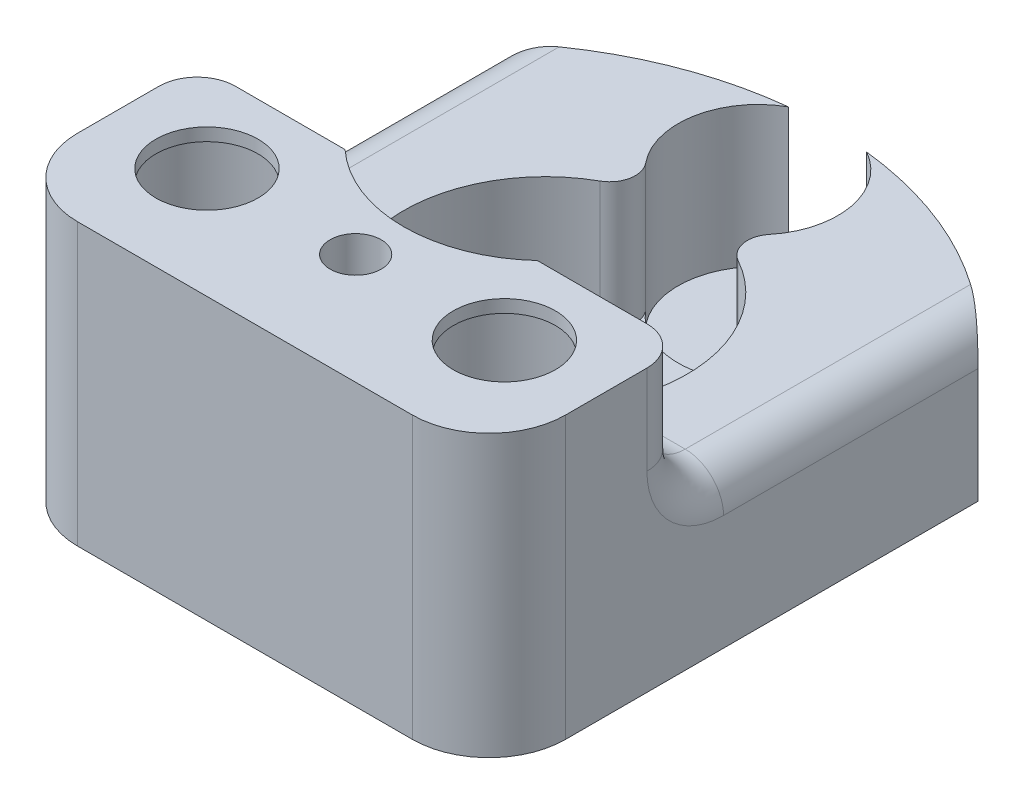
from build123d import *

# Parameters (mm, degrees)
SKETCH1_R                = 34.445
BOSS_EXTRUDE1_DEPTH      = 22
SKETCH15_R               = 34.445
CUT_EXTRUDE2_DEPTH       = 54.450126754
CUT_EXTRUDE4_START       = -1
SKETCH17_R               = 6.2
CUT_EXTRUDE4_DEPTH       = 20
SKETCH18_R               = 7.25
CUT_EXTRUDE5_DEPTH       = 41.489614217
SKETCH19_R               = 6.25
CUT_EXTRUDE7_DEPTH       = 21
SKETCH20_R               = 9.845995641
CUT_EXTRUDE9_DEPTH       = 10
FILLET12_R               = 6
SKETCH23_R               = 4
SKETCH23_R_2             = 2
CUT_EXTRUDE10_DEPTH      = 41.489614217
CUT_EXTRUDE11_START      = -12
CUT_EXTRUDE11_DEPTH      = 29.489614217
FILLET19_R               = 3
CUT_EXTRUDE12_DEPTH      = 10
CUT_EXTRUDE12_DEPTH_BACK = 10
SKETCH25_R               = 11.1
FILLET20_R               = 2


with BuildPart() as part:
    # Sketch1 → Boss-Extrude1 (new body)
    with BuildSketch(Plane(origin=(0, 0, 0), x_dir=(1, 0, 0), z_dir=(0, 1, 0))):
        with Locations(Location((0, 0, 0), (0, 0, 270))):
            Circle(SKETCH1_R)
    extrude(amount=BOSS_EXTRUDE1_DEPTH)

    # Sketch15 → Cut-Extrude2 (cut, through all)
    with BuildSketch(Plane(origin=(0, 22, 0), x_dir=(1, 0, 0), z_dir=(0, 1, 0))):
        Circle(SKETCH15_R)
        with BuildLine():
            Line((-19.109582045, 20.616901016), (-19.109582045, -17.678671312))
            Line((-19.109582045, -17.678671312), (19.109582045, -17.678671312))
            Line((19.109582045, -17.678671312), (19.109582045, 20.616901016))
            ThreePointArc((19.109582045, 20.616901016), (0, 28.111078483), (-19.109582045, 20.616901016))
        make_face(mode=Mode.SUBTRACT)
    extrude(amount=-CUT_EXTRUDE2_DEPTH, mode=Mode.SUBTRACT)

    # Sketch17 → Cut-Extrude4 (cut)
    with BuildSketch(Plane(origin=(0, 22, 0), x_dir=(1, 0, 0), z_dir=(0, 1, 0)).offset(CUT_EXTRUDE4_START)):
        with Locations(Location((-11.644122412, -9.008465082, 0), (0, 0, 270))):
            Circle(SKETCH17_R)
        with Locations(Location((11.644122412, -9.008465082, 0), (0, 0, 90))):
            Circle(SKETCH17_R)
    extrude(amount=-CUT_EXTRUDE4_DEPTH, mode=Mode.SUBTRACT)

    # Sketch18 → Cut-Extrude5 (cut, through all)
    with BuildSketch(Plane(origin=(0, 22, 0), x_dir=(1, 0, 0), z_dir=(0, 1, 0))):
        with Locations(Location((0, 5.846291401, 0), (0, 0, 270))):
            Circle(SKETCH18_R)
    extrude(amount=-CUT_EXTRUDE5_DEPTH, mode=Mode.SUBTRACT)

    # Sketch19 → Cut-Extrude7 (cut)
    with BuildSketch(Plane(origin=(0, 22, 0), x_dir=(1, 0, 0), z_dir=(0, 1, 0))):
        with Locations((0, 22.497935332)):
            Circle(SKETCH19_R)
    extrude(amount=-CUT_EXTRUDE7_DEPTH, mode=Mode.SUBTRACT)

    # Sketch20 → Cut-Extrude9 (cut)
    with BuildSketch(Plane(origin=(0, 22, 0), x_dir=(1, 0, 0), z_dir=(0, 1, 0))):
        with Locations(Location((0, 5.846291401, 0), (0, 0, 270))):
            Circle(SKETCH20_R)
    extrude(amount=-CUT_EXTRUDE9_DEPTH, mode=Mode.SUBTRACT)

    # Fillet12
    fillet12_edges = [part.edges().sort_by_distance(p)[0] for p in [
        (-19.109582045, 11, 17.678671312),
        (19.109582045, 11, 17.678671312),
    ]]
    fillet(fillet12_edges, radius=FILLET12_R)

    # Sketch23 → Cut-Extrude10 (cut, through all)
    with BuildSketch(Plane(origin=(0, 22, 0), x_dir=(1, 0, 0), z_dir=(0, 1, 0))):
        with Locations(Location((-11.644122412, -9.008465082, 0), (0, 0, 270))):
            Circle(SKETCH23_R)
        with Locations(Location((11.644122412, -9.008465082, 0), (0, 0, 270))):
            Circle(SKETCH23_R)
        with Locations(Location((0, -9.008465082, 0), (0, 0, 270))):
            Circle(SKETCH23_R_2)
    extrude(amount=-CUT_EXTRUDE10_DEPTH, mode=Mode.SUBTRACT)

    # Sketch24 → Cut-Extrude11 (cut, through all)
    with BuildSketch(Plane.XZ.offset(CUT_EXTRUDE11_START)):
        with BuildLine():
            Line((-19.109582045, -20.616901016), (-19.109582045, 2.30978602))
            Line((-19.109582045, 2.30978602), (19.109582045, 2.30978602))
            Line((19.109582045, 2.30978602), (19.109582045, -20.616901016))
            ThreePointArc((19.109582045, -20.616901016), (0, -28.111078483), (-19.109582045, -20.616901016))
        make_face()
    extrude(amount=-CUT_EXTRUDE11_DEPTH, mode=Mode.SUBTRACT)

    # Fillet19
    fillet19_edges = [part.edges().sort_by_distance(p)[0] for p in [
        (-19.109582045, 17, 2.30978602),
        (12.31259954, 12, 2.30978602),
        (-12.31259954, 12, 2.30978602),
        (-19.109582045, 12, -9.153557498),
        (19.109582045, 12, -9.153557498),
        (19.109582045, 17, 2.30978602),
    ]]
    fillet(fillet19_edges, radius=FILLET19_R)

    # Sketch25 → Cut-Extrude12 (cut, two sides: drawn at the far end of the back side and taken through both)
    with BuildSketch(Plane(origin=(0, 12, 0), x_dir=(1, 0, 0), z_dir=(0, 1, 0)).offset(-CUT_EXTRUDE12_DEPTH_BACK)):
        with Locations((0, 5.846291401)):
            Circle(SKETCH25_R)
    extrude(amount=CUT_EXTRUDE12_DEPTH + CUT_EXTRUDE12_DEPTH_BACK, mode=Mode.SUBTRACT)

    # Fillet20
    fillet20_edges = [part.edges().sort_by_distance(p)[0] for p in [
        (-2.330818134, 7, -16.698815845),
        (2.330818134, 7, -16.698815845),
    ]]
    fillet(fillet20_edges, radius=FILLET20_R)


solid = part.part
